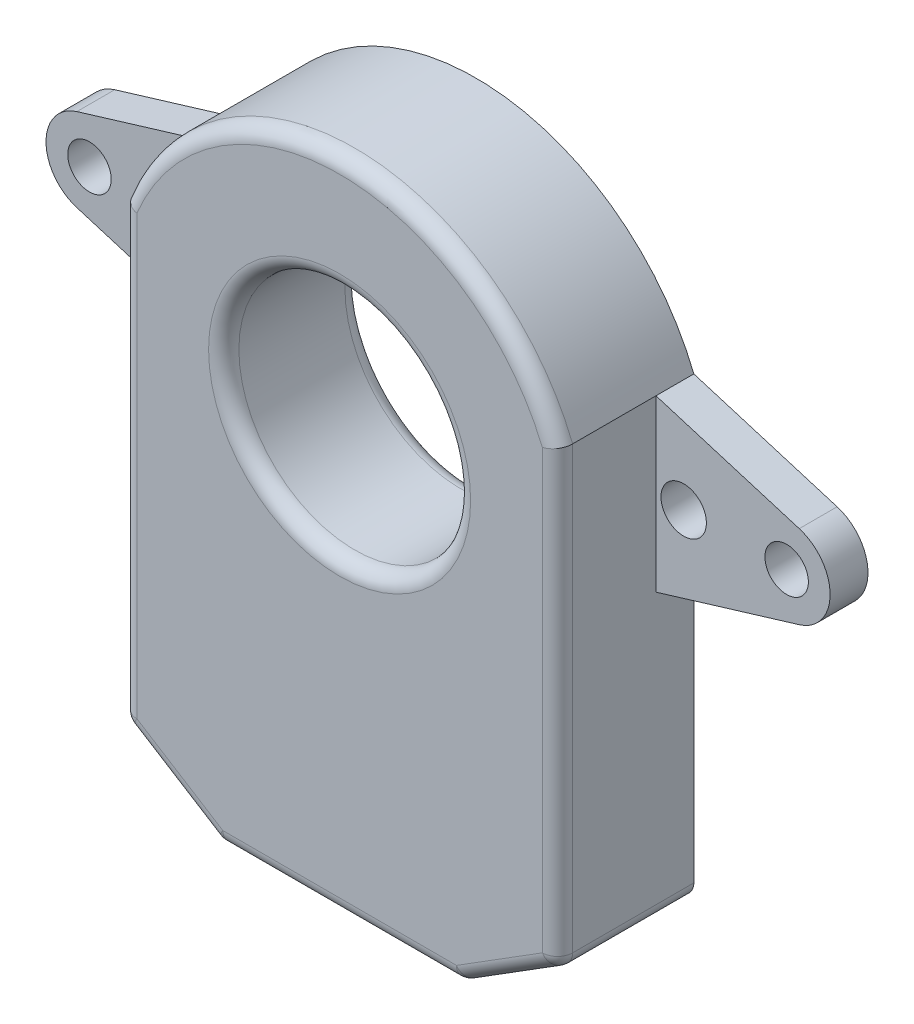
from build123d import *

# Parameters (mm, degrees)
SKETCH1_R           = 7.65
BOSS_EXTRUDE1_DEPTH = 9
FILLET1_R           = 1
SKETCH2_R           = 1.5
SKETCH2_R_2         = 1.435
BOSS_EXTRUDE2_DEPTH = 2.5


with BuildPart() as part:
    # Sketch1 → Boss-Extrude1 (new body)
    with BuildSketch(Plane.XY):
        with BuildLine():
            Line((6.385, 0), (22.385, 0))
            Line((22.385, 0), (28.77, 4))
            Line((28.77, 4), (28.77, 33.652501624))
            ThreePointArc((28.77, 33.652501624), (14.385, 43.38), (0, 33.652501624))
            Line((0, 33.652501624), (0, 4))
            Line((0, 4), (6.385, 0))
        make_face()
        with Locations((14.385, 28.04)):
            Circle(SKETCH1_R, mode=Mode.SUBTRACT)
    extrude(amount=BOSS_EXTRUDE1_DEPTH)

    # Fillet1
    fillet1_edges = [part.edges().sort_by_distance(p)[0] for p in [
        (25.5775, 2, 9),
        (0, 4, 4.5),
        (28.77, 4, 4.5),
        (22.385, 0, 4.5),
        (6.385, 0, 4.5),
        (28.77, 18.826250812, 9),
        (14.385, 43.38, 9),
        (6.735, 28.04, 0),
        (6.735, 28.04, 9),
        (0, 18.826250812, 9),
        (3.1925, 2, 9),
        (14.385, 0, 9),
    ]]
    fillet(fillet1_edges, radius=FILLET1_R)

    # Sketch2 → Boss-Extrude2 (add)
    # profile 1 of 2: a face of its own
    with BuildSketch(Plane(origin=(0, 0, 0), x_dir=(-1, 0, 0), z_dir=(0, 0, -1))):
        with BuildLine():
            Line((-28.77, 33.652501624), (-38.229616207, 30.786722159))
            ThreePointArc((-38.229616207, 30.786722159), (-40.2675, 28.04), (-38.229616207, 25.293277841))
            Line((-38.229616207, 25.293277841), (-28.77, 22.427498376))
            Line((-28.77, 22.427498376), (-28.77, 33.652501624))
        make_face()
        with Locations((-30.6, 28.04)):
            Circle(SKETCH2_R, mode=Mode.SUBTRACT)
        with Locations((-37.3975, 28.04)):
            Circle(SKETCH2_R_2, mode=Mode.SUBTRACT)
    # profile 2 of 2: a face of its own
    with BuildSketch(Plane(origin=(0, 0, 0), x_dir=(-1, 0, 0), z_dir=(0, 0, -1))):
        with BuildLine():
            Line((0, 22.427498376), (9.459616207, 25.293277841))
            ThreePointArc((9.459616207, 25.293277841), (11.4975, 28.04), (9.459616207, 30.786722159))
            Line((9.459616207, 30.786722159), (0, 33.652501624))
            Line((0, 33.652501624), (0, 22.427498376))
        make_face()
        with Locations(Location((8.6275, 28.04, 0), (0, 0, 180))):
            Circle(SKETCH2_R_2, mode=Mode.SUBTRACT)
        with Locations(Location((1.83, 28.04, 0), (0, 0, 180))):
            Circle(SKETCH2_R, mode=Mode.SUBTRACT)
    extrude(amount=-BOSS_EXTRUDE2_DEPTH)


solid = part.part
